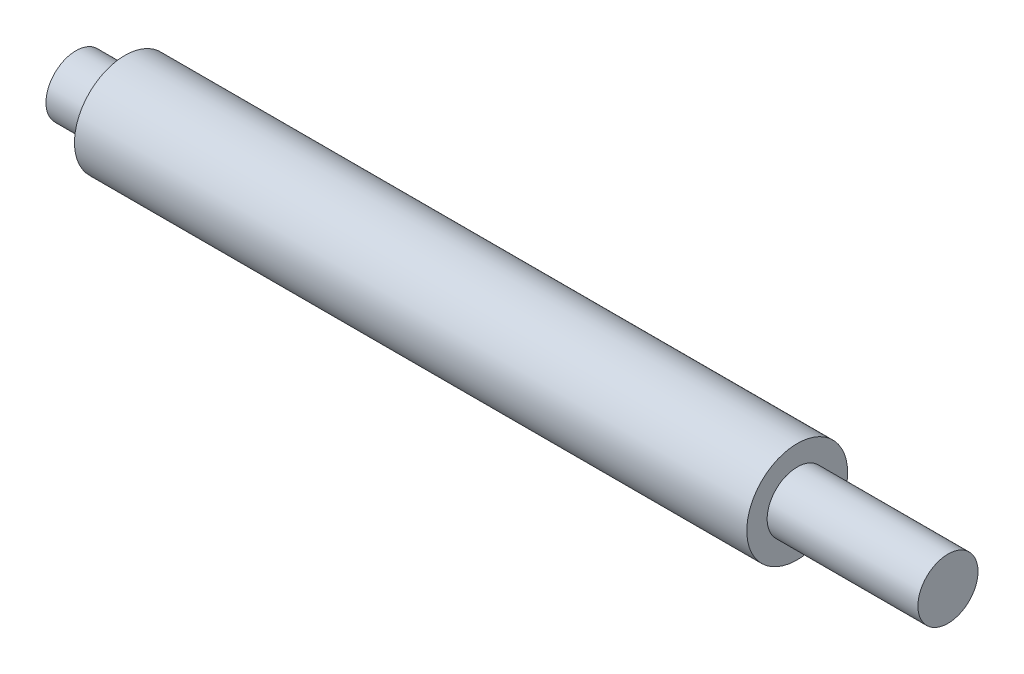
from build123d import *

# Parameters (mm, degrees)
SKETCH1_R           = 2.95
BOSS_EXTRUDE1_DEPTH = 4.8
SKETCH2_R           = 4.95
BOSS_EXTRUDE2_DEPTH = 66
SKETCH3_R           = 2.95
BOSS_EXTRUDE3_DEPTH = 14.8


with BuildPart() as part:
    # Sketch1 → Boss-Extrude1 (new body)
    with BuildSketch(Plane.YZ):
        with Locations(Location((0, 0, 0), (0, 0, 270))):
            Circle(SKETCH1_R)
    extrude(amount=BOSS_EXTRUDE1_DEPTH)

    # Sketch2 → Boss-Extrude2 (add)
    with BuildSketch(Plane.YZ.offset(4.8)):
        with Locations(Location((0, 0, 0), (0, 0, 270))):
            Circle(SKETCH2_R)
    extrude(amount=BOSS_EXTRUDE2_DEPTH)

    # Sketch3 → Boss-Extrude3 (add)
    with BuildSketch(Plane.YZ.offset(70.8)):
        with Locations(Location((0, 0, 0), (0, 0, 270))):
            Circle(SKETCH3_R)
    extrude(amount=BOSS_EXTRUDE3_DEPTH)


solid = part.part
